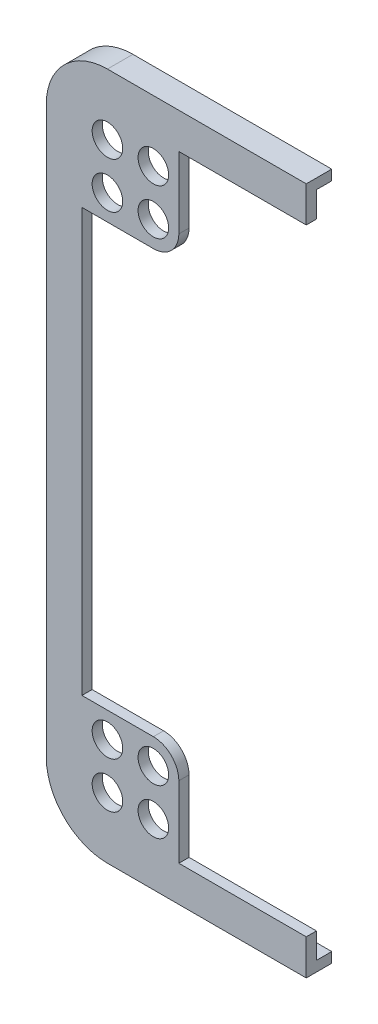
from build123d import *

# Parameters (mm, degrees)
SKETCH24_W              = 19.01040764
SKETCH24_H              = 82.93150469
SKETCH24_W_2            = 50
SKETCH24_H_2            = 120.95231997
BOSS_EXTRUDE1_DEPTH     = 2
SKETCH25_W              = 51.01040764
SKETCH25_H              = 134.95231997
BOSS_EXTRUDE2_DEPTH     = 5
CUT_EXTRUDE2_DEPTH      = 303.633154318
CUT_EXTRUDE2_DEPTH_BACK = 303.633154318
SKETCH24_3_W            = 19.01040764
SKETCH24_3_H            = 82.93150469
SKETCH24_3_W_2          = 50
SKETCH24_3_H_2          = 120.95231997
CUT_EXTRUDE3_DEPTH      = 3
FILLET1_R               = 12
SKETCH28_R              = 3
CUT_EXTRUDE4_DEPTH      = 150.018673002
FILLET2_R               = 5


with BuildPart() as part:
    # Sketch24 → Boss-Extrude1 (new body)
    with BuildSketch(Plane.XY):
        with Locations((20.91706823, 70.762534541)):
            Rectangle(SKETCH24_W, SKETCH24_H)
        with Locations((55.42227205, 70.762534541)):
            Rectangle(SKETCH24_W_2, SKETCH24_H_2)
        Polygon((250.158478802, 10.286374556), (250.158478802, 29.296782196), (250.158478802, 112.228286886), (250.158478802, 131.238694526), (200.158478802, 131.238694526), (200.158478802, 10.286374556), align=None)
        with Locations((259.663682622, 70.762534541)):
            Rectangle(SKETCH24_W, SKETCH24_H)
    extrude(amount=-BOSS_EXTRUDE1_DEPTH)

    # Sketch25 → Boss-Extrude2 (add)
    with BuildSketch(Plane.XY):
        with Locations((29.91706823, 70.762534541)):
            Rectangle(SKETCH25_W, SKETCH25_H)
    extrude(amount=BOSS_EXTRUDE2_DEPTH)

    # Sketch24<3> → Cut-Extrude2 (cut, two sides: drawn at the far end of the back side and taken through both)
    with BuildSketch(Plane.XY.offset(-CUT_EXTRUDE2_DEPTH_BACK)):
        with Locations((20.91706823, 70.762534541)):
            Rectangle(SKETCH24_3_W, SKETCH24_3_H)
        with Locations((55.42227205, 70.762534541)):
            Rectangle(SKETCH24_3_W_2, SKETCH24_3_H_2)
        Polygon((250.158478802, 10.286374556), (250.158478802, 29.296782196), (250.158478802, 112.228286886), (250.158478802, 131.238694526), (200.158478802, 131.238694526), (200.158478802, 10.286374556), align=None)
        with Locations((259.663682622, 70.762534541)):
            Rectangle(SKETCH24_3_W, SKETCH24_3_H)
    extrude(amount=CUT_EXTRUDE2_DEPTH + CUT_EXTRUDE2_DEPTH_BACK, mode=Mode.SUBTRACT)

    # Sketch2 → Cut-Extrude3 (cut)
    with BuildSketch(Plane.XY):
        with BuildLine():
            Line((16.41186441, 136.238694526), (264.168886442, 136.238694526))
            ThreePointArc((264.168886442, 136.238694526), (271.239954254, 133.309762338), (274.168886442, 126.238694526))
            Line((274.168886442, 126.238694526), (274.168886442, 15.286374556))
            ThreePointArc((274.168886442, 15.286374556), (271.239954254, 8.215306744), (264.168886442, 5.286374556))
            Line((264.168886442, 5.286374556), (16.41186441, 5.286374556))
            ThreePointArc((16.41186441, 5.286374556), (9.340796598, 8.215306744), (6.41186441, 15.286374556))
            Line((6.41186441, 15.286374556), (6.41186441, 126.238694526))
            ThreePointArc((6.41186441, 126.238694526), (9.340796598, 133.309762338), (16.41186441, 136.238694526))
        make_face()
    extrude(amount=CUT_EXTRUDE3_DEPTH, mode=Mode.SUBTRACT)

    # Fillet1
    fillet1_edges = [part.edges().sort_by_distance(p)[0] for p in [
        (4.41186441, 138.238694526, 2.5),
        (4.41186441, 3.286374556, 2.5),
    ]]
    fillet(fillet1_edges, radius=FILLET1_R)

    # Sketch28 → Cut-Extrude4 (cut, through all)
    with BuildSketch(Plane.XY):
        with Locations((25.42227205, 117.228286886)):
            Circle(SKETCH28_R)
        with Locations((16.41186441, 15.286374556)):
            Circle(SKETCH28_R)
        with Locations((16.41186441, 117.228286886)):
            Circle(SKETCH28_R)
        with Locations((25.42227205, 15.286374556)):
            Circle(SKETCH28_R)
        with Locations((25.42227205, 24.296782196)):
            Circle(SKETCH28_R)
        with Locations((16.41186441, 24.296782196)):
            Circle(SKETCH28_R)
        with Locations((25.42227205, 126.238694526)):
            Circle(SKETCH28_R)
        with Locations((16.41186441, 126.238694526)):
            Circle(SKETCH28_R)
    extrude(amount=CUT_EXTRUDE4_DEPTH, mode=Mode.SUBTRACT)

    # Fillet2
    fillet2_edges = [part.edges().sort_by_distance(p)[0] for p in [
        (30.42227205, 29.296782196, 4),
        (30.42227205, 112.228286886, 4),
    ]]
    fillet(fillet2_edges, radius=FILLET2_R)


solid = part.part
